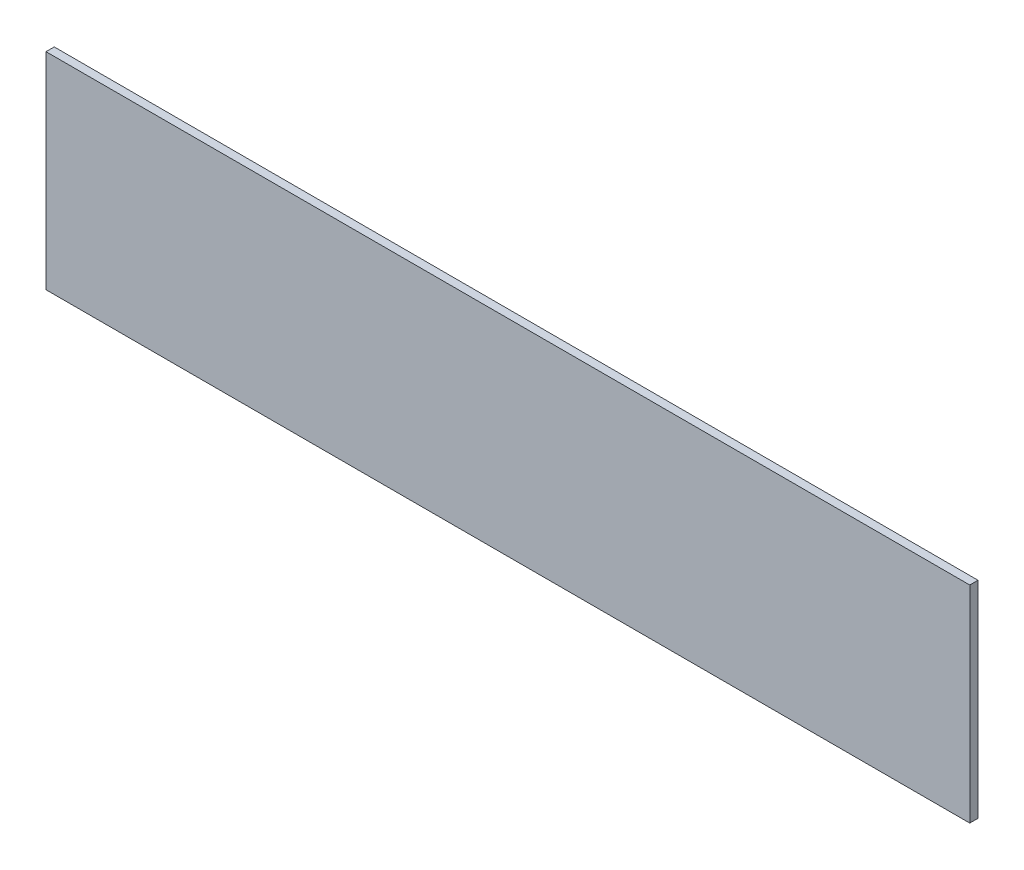
from build123d import *

# Parameters (mm, degrees)
SKETCH1_W           = 224
SKETCH1_H           = 50
BOSS_EXTRUDE1_DEPTH = 1


with BuildPart() as part:
    # Sketch1 → Boss-Extrude1 (new, symmetric)
    with BuildSketch(Plane.XY):
        Rectangle(SKETCH1_W, SKETCH1_H)
    extrude(amount=BOSS_EXTRUDE1_DEPTH, both=True)


solid = part.part
